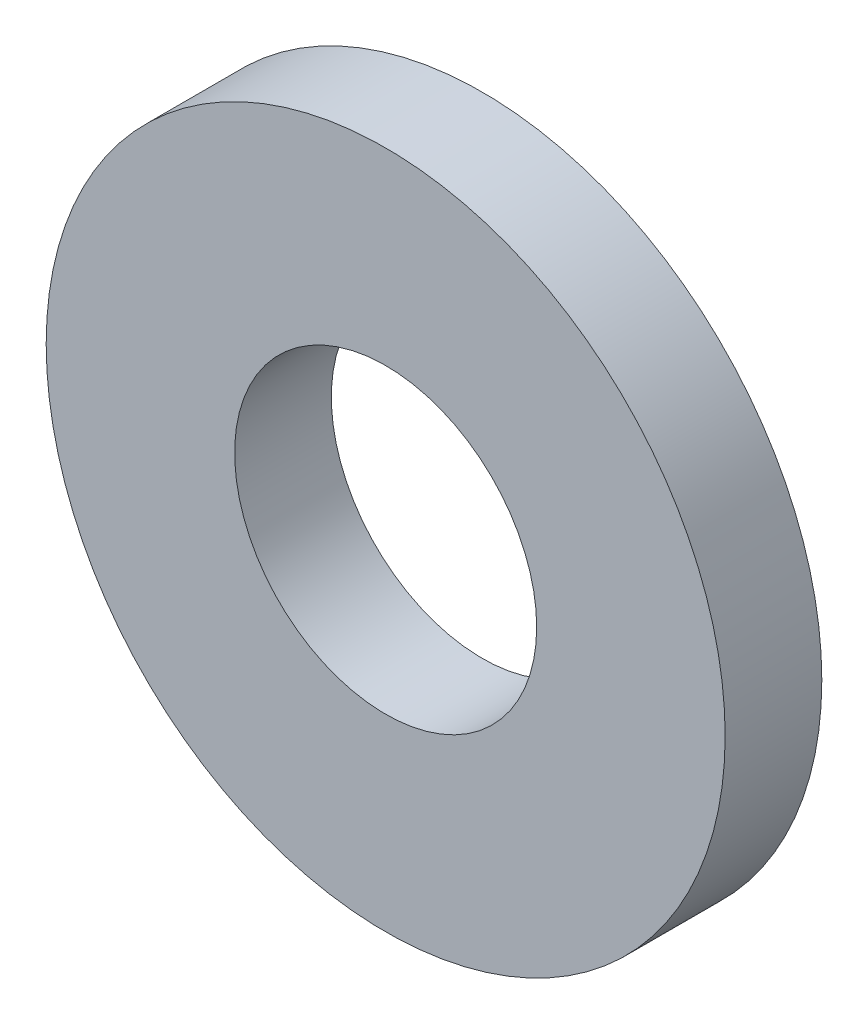
from build123d import *

# Parameters (mm, degrees)
SKETCH1_W = 3.9624
SKETCH1_H = 2.032


with BuildPart() as part:
    # Sketch1 → Revolve1 (revolve)
    with BuildSketch(Plane(origin=(0, 0, 0), x_dir=(1, 0, 0), z_dir=(0, 1, 0))):
        with Locations((5.1562, 1.016)):
            Rectangle(SKETCH1_W, SKETCH1_H)
    revolve(axis=Axis((0, 0, -2.032), (0, 0, 1)))


solid = part.part
